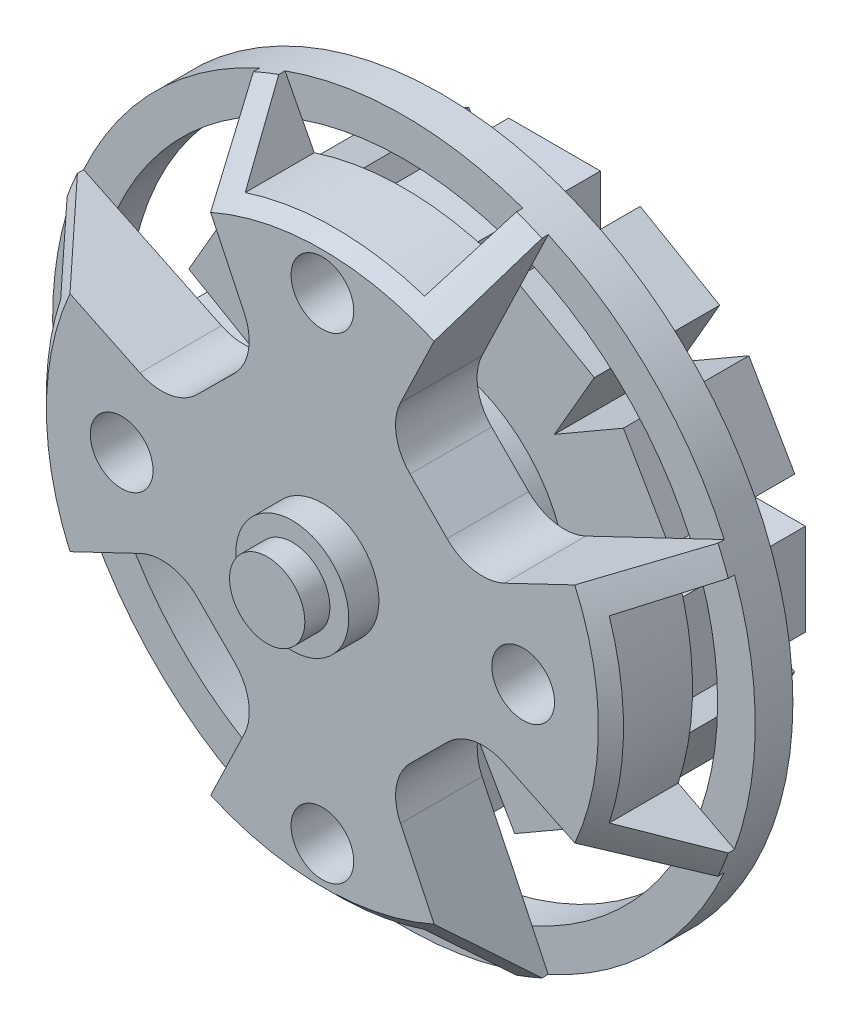
from build123d import *
from build123d.topology import SkipClean

# Parameters (mm, degrees)
EXTRUDE_1_DEPTH     = 3.25
EXTRUDE_START       = 1.5
SKETCH_2_R          = 14.000000000000027
SKETCH_2_R_2        = 12.499999999999906
EXTRUDE_2_DEPTH     = 1.5
CHAMFER_1_SIZE      = 3
CUT_EXTRUDE_2_REACH = 22.361
SKETCH_3_R          = 1.2500000000000002
SKETCH_3_R_2        = 1.2499999999999991
SKETCH_3_R_3        = 1.2499999999999998
SKETCH_3_R_4        = 1.250000000000001
SKETCH_4_R          = 2.25
EXTRUDE_3_DEPTH     = 1.2
SKETCH_6_R          = 1.5
EXTRUDE_4_DEPTH     = 1
SKETCH_7_R          = 5.5
EXTRUDE_5_DEPTH     = 1
EXTRUDE_6_DEPTH     = 5


with BuildPart() as part:
    # Эскиз1 → Бобышка-Вытянуть1 (new body)
    with BuildSketch(Plane.XY):
        with BuildLine():
            Line((-7.272076584167655, 3.111154183095137), (-12.764697411219743, 5.749999999999998))
            ThreePointArc((-12.764697411219743, 5.749999999999998), (-13.687690889209106, 2.9405982591067765), (-13.999999999999988, 0))
            ThreePointArc((-13.999999999999988, 0), (-13.68769088920912, -2.9405982591067032), (-12.764697411219801, -5.749999999999867))
            Line((-12.764697411219801, -5.749999999999867), (-7.25261222668815, -3.113400385794882))
            ThreePointArc((-7.25261222668815, -3.113400385794882), (-6.047780294633424, -2.947046212491201), (-4.969360809785696, -3.5094563032390873))
            Line((-4.969360809785696, -3.5094563032390873), (-3.493656572586229, -4.997814070292929))
            ThreePointArc((-3.493656572586229, -4.997814070292929), (-2.9415951503787445, -6.074261578843696), (-3.111154183095193, -7.272076584167621))
            Line((-3.111154183095193, -7.272076584167621), (-5.75000000000013, -12.764697411219682))
            ThreePointArc((-5.75000000000013, -12.764697411219682), (-2.940598259106871, -13.687690889209117), (-4.974e-14, -14.00000000000005))
            ThreePointArc((-4.974e-14, -14.00000000000005), (2.940598259106699, -13.687690889209104), (5.74999999999991, -12.764697411219782))
            Line((5.74999999999991, -12.764697411219782), (3.113400385794907, -7.252612226688141))
            ThreePointArc((3.113400385794907, -7.252612226688141), (2.9470462124912205, -6.047780294633415), (3.509456303239104, -4.969360809785686))
            Line((3.509456303239104, -4.969360809785686), (4.99781407029294, -3.493656572586213))
            ThreePointArc((4.99781407029294, -3.493656572586213), (6.074261578843707, -2.941595150378726), (7.272076584167633, -3.1111541830951692))
            Line((7.272076584167633, -3.1111541830951692), (12.764697411219702, -5.750000000000088))
            ThreePointArc((12.764697411219702, -5.750000000000088), (13.687690889209112, -2.9405982591068236), (14.00000000000005, 8.8e-16))
            ThreePointArc((14.00000000000005, 8.8e-16), (13.687690889209128, 2.9405982591067543), (12.764697411219764, 5.749999999999957))
            Line((12.764697411219764, 5.749999999999957), (7.2526122266881305, 3.113400385794934))
            ThreePointArc((7.2526122266881305, 3.113400385794934), (6.047780294633405, 2.9470462124912435), (4.969360809785673, 3.5094563032391233))
            Line((4.969360809785673, 3.5094563032391233), (3.493656572586196, 4.9978140702929545))
            ThreePointArc((3.493656572586196, 4.9978140702929545), (2.9415951503787046, 6.074261578843718), (3.111154183095144, 7.272076584167644))
            Line((3.111154183095144, 7.272076584167644), (5.750000000000043, 12.764697411219723))
            ThreePointArc((5.750000000000043, 12.764697411219723), (2.940598259106772, 13.68769088920909), (-4.802e-14, 14.00000000000005))
            ThreePointArc((-4.802e-14, 14.00000000000005), (-2.940598259106804, 13.687690889209133), (-5.75, 12.764697411219743))
            Line((-5.75, 12.764697411219743), (-3.113400385794959, 7.252612226688119))
            ThreePointArc((-3.113400385794959, 7.252612226688119), (-2.947046212491262, 6.047780294633395), (-3.5094563032391375, 4.969360809785661))
            Line((-3.5094563032391375, 4.969360809785661), (-4.997814070292954, 3.4936565725861874))
            ThreePointArc((-4.997814070292954, 3.4936565725861874), (-6.074261578843724, 2.941595150378682), (-7.272076584167655, 3.111154183095137))
        make_face()
    extrude(amount=EXTRUDE_1_DEPTH)

    # Эскиз2 → Бобышка-Вытянуть2 (add)
    with SkipClean():  # the faces are left unmerged after this step: merging them gives an invalid solid
        with BuildSketch(Plane(origin=(0, 0, 0), x_dir=(-1, 0, 0), z_dir=(0, 0, -1)).offset(EXTRUDE_START)):
            Circle(SKETCH_2_R)
            with Locations(Location((0, 0, 0), (0, 0, 204.080288301))):
                Circle(SKETCH_2_R_2, mode=Mode.SUBTRACT)
        extrude(amount=-EXTRUDE_2_DEPTH)

    # Фаска1
    chamfer_1_edges = [part.edges().sort_by_distance(p)[0] for p in [
        (-1.7286e-13, -14.000000000000046, 3.25),
        (-13.999999999999986, 7.35e-14, 3.25),
        (14.00000000000005, -9.981e-14, 3.25),
        (3.486e-14, 14.00000000000005, 3.25),
    ]]
    chamfer(chamfer_1_edges, length=CHAMFER_1_SIZE)

    # Вырез-Вытянуть2: up to this face of the body (flat: up to its plane)
    cut_extrude_2_end = Plane(part.part.faces().sort_by_distance((0, 0, 0))[0])
    # Эскиз3 → Вырез-Вытянуть2 (cut, up to the picked face)
    with BuildSketch(Plane.XY.offset(3.25), mode=Mode.PRIVATE) as cut_extrude_2_sk1:
        with Locations((-8, 0)):
            Circle(SKETCH_3_R)
    cut_extrude_2_tool1 = split(extrude(cut_extrude_2_sk1.sketch, amount=-CUT_EXTRUDE_2_REACH, mode=Mode.PRIVATE), bisect_by=cut_extrude_2_end, keep=Keep.BOTH, mode=Mode.PRIVATE)
    # Эскиз3 → Вырез-Вытянуть2 (cut, up to the picked face)
    with BuildSketch(Plane.XY.offset(3.25), mode=Mode.PRIVATE) as cut_extrude_2_sk2:
        with Locations((8, 0)):
            Circle(SKETCH_3_R_2)
    cut_extrude_2_tool2 = split(extrude(cut_extrude_2_sk2.sketch, amount=-CUT_EXTRUDE_2_REACH, mode=Mode.PRIVATE), bisect_by=cut_extrude_2_end, keep=Keep.BOTH, mode=Mode.PRIVATE)
    # Эскиз3 → Вырез-Вытянуть2 (cut, up to the picked face)
    with BuildSketch(Plane.XY.offset(3.25), mode=Mode.PRIVATE) as cut_extrude_2_sk3:
        with Locations((0, 9.5)):
            Circle(SKETCH_3_R_3)
    cut_extrude_2_tool3 = split(extrude(cut_extrude_2_sk3.sketch, amount=-CUT_EXTRUDE_2_REACH, mode=Mode.PRIVATE), bisect_by=cut_extrude_2_end, keep=Keep.BOTH, mode=Mode.PRIVATE)
    # Эскиз3 → Вырез-Вытянуть2 (cut, up to the picked face)
    with BuildSketch(Plane.XY.offset(3.25), mode=Mode.PRIVATE) as cut_extrude_2_sk4:
        with Locations((0, -9.5)):
            Circle(SKETCH_3_R_4)
    cut_extrude_2_tool4 = split(extrude(cut_extrude_2_sk4.sketch, amount=-CUT_EXTRUDE_2_REACH, mode=Mode.PRIVATE), bisect_by=cut_extrude_2_end, keep=Keep.BOTH, mode=Mode.PRIVATE)
    # Эскиз3 → Вырез-Вытянуть2 (cut, up to the picked face)
    with BuildSketch(Plane.XY.offset(3.25), mode=Mode.PRIVATE) as cut_extrude_2_sk5:
        with BuildLine():
            Line((-4.738786646254797, 13.173606230690137), (-3.574525297896844, 10.930359961808032))
            ThreePointArc((-3.574525297896844, 10.930359961808032), (7e-16, 11.500000000000027), (3.574525297896844, 10.930359961808032))
            Line((3.574525297896844, 10.930359961808032), (4.738786646254797, 13.173606230690137))
            ThreePointArc((4.738786646254797, 13.173606230690137), (8.6e-16, 14.000000000000028), (-4.738786646254797, 13.173606230690137))
        make_face()
    cut_extrude_2_tool5 = split(extrude(cut_extrude_2_sk5.sketch, amount=-CUT_EXTRUDE_2_REACH, mode=Mode.PRIVATE), bisect_by=cut_extrude_2_end, keep=Keep.BOTH, mode=Mode.PRIVATE)
    # Эскиз3 → Вырез-Вытянуть2 (cut, up to the picked face)
    with BuildSketch(Plane.XY.offset(3.25), mode=Mode.PRIVATE) as cut_extrude_2_sk6:
        with BuildLine():
            Line((13.173606230690154, 4.738786646254751), (10.930359961808044, 3.574525297896806))
            ThreePointArc((10.930359961808044, 3.574525297896806), (11.500000000000027, -4.022e-14), (10.93035996180802, -3.5745252978968822))
            Line((10.93035996180802, -3.5745252978968822), (13.173606230690119, -4.738786646254843))
            ThreePointArc((13.173606230690119, -4.738786646254843), (14.000000000000027, -4.896e-14), (13.173606230690154, 4.738786646254751))
        make_face()
    cut_extrude_2_tool6 = split(extrude(cut_extrude_2_sk6.sketch, amount=-CUT_EXTRUDE_2_REACH, mode=Mode.PRIVATE), bisect_by=cut_extrude_2_end, keep=Keep.BOTH, mode=Mode.PRIVATE)
    # Эскиз3 → Вырез-Вытянуть2 (cut, up to the picked face)
    with BuildSketch(Plane.XY.offset(3.25), mode=Mode.PRIVATE) as cut_extrude_2_sk7:
        with BuildLine():
            Line((4.738786646254705, -13.173606230690169), (3.5745252978967677, -10.930359961808056))
            ThreePointArc((3.5745252978967677, -10.930359961808056), (-8.101e-14, -11.500000000000027), (-3.5745252978969204, -10.930359961808007))
            Line((-3.5745252978969204, -10.930359961808007), (-4.738786646254889, -13.173606230690103))
            ThreePointArc((-4.738786646254889, -13.173606230690103), (-9.862e-14, -14.000000000000027), (4.738786646254705, -13.173606230690169))
        make_face()
    cut_extrude_2_tool7 = split(extrude(cut_extrude_2_sk7.sketch, amount=-CUT_EXTRUDE_2_REACH, mode=Mode.PRIVATE), bisect_by=cut_extrude_2_end, keep=Keep.BOTH, mode=Mode.PRIVATE)
    # Эскиз3 → Вырез-Вытянуть2 (cut, up to the picked face)
    with BuildSketch(Plane.XY.offset(3.25), mode=Mode.PRIVATE) as cut_extrude_2_sk8:
        with BuildLine():
            Line((-13.173606230690186, -4.738786646254658), (-10.930359961808069, -3.574525297896729))
            ThreePointArc((-10.930359961808069, -3.574525297896729), (-11.500000000000025, 1.2116e-13), (-10.930359961807993, 3.5745252978969595))
            Line((-10.930359961807993, 3.5745252978969595), (-13.173606230690085, 4.738786646254936))
            ThreePointArc((-13.173606230690085, 4.738786646254936), (-14.000000000000027, 1.5093e-13), (-13.173606230690186, -4.738786646254658))
        make_face()
    cut_extrude_2_tool8 = split(extrude(cut_extrude_2_sk8.sketch, amount=-CUT_EXTRUDE_2_REACH, mode=Mode.PRIVATE), bisect_by=cut_extrude_2_end, keep=Keep.BOTH, mode=Mode.PRIVATE)
    add(cut_extrude_2_tool1.solids().sort_by(Axis((-8, 0, 3.25), (0, 0, -1)))[0], mode=Mode.SUBTRACT)
    add(cut_extrude_2_tool2.solids().sort_by(Axis((8, 0, 3.25), (0, 0, -1)))[0], mode=Mode.SUBTRACT)
    add(cut_extrude_2_tool3.solids().sort_by(Axis((0, 9.5, 3.25), (0, 0, -1)))[0], mode=Mode.SUBTRACT)
    add(cut_extrude_2_tool4.solids().sort_by(Axis((0, -9.5, 3.25), (0, 0, -1)))[0], mode=Mode.SUBTRACT)
    add(cut_extrude_2_tool5.solids().sort_by(Axis((0, 12.573718, 3.25), (0, 0, -1)))[0], mode=Mode.SUBTRACT)
    add(cut_extrude_2_tool6.solids().sort_by(Axis((12.573718, 0, 3.25), (0, 0, -1)))[0], mode=Mode.SUBTRACT)
    add(cut_extrude_2_tool7.solids().sort_by(Axis((0, -12.573718, 3.25), (0, 0, -1)))[0], mode=Mode.SUBTRACT)
    add(cut_extrude_2_tool8.solids().sort_by(Axis((-12.573718, 0, 3.25), (0, 0, -1)))[0], mode=Mode.SUBTRACT)

    # Эскиз4 → Бобышка-Вытянуть3 (add)
    with SkipClean():  # the faces are left unmerged after this step: merging them gives an invalid solid
        with BuildSketch(Plane.XY.offset(3.25)):
            with Locations(Location((0, 0, 0), (0, 0, 180))):
                Circle(SKETCH_4_R)
        extrude(amount=EXTRUDE_3_DEPTH)

    # Эскиз6 → Бобышка-Вытянуть4 (add)
    with SkipClean():  # the faces are left unmerged after this step: merging them gives an invalid solid
        with BuildSketch(Plane.XY.offset(4.45)):
            Circle(SKETCH_6_R)
        extrude(amount=EXTRUDE_4_DEPTH)

    # Эскиз7 → Бобышка-Вытянуть5 (add)
    with SkipClean():  # the faces are left unmerged after this step: merging them gives an invalid solid
        with BuildSketch(Plane(origin=(0, 0, 0), x_dir=(-1, 0, 0), z_dir=(0, 0, -1))):
            Circle(SKETCH_7_R)
        extrude(amount=EXTRUDE_5_DEPTH)

    # Эскиз8 → Бобышка-Вытянуть6 (add)
    with SkipClean():  # the faces are left unmerged after this step: merging them gives an invalid solid
        with BuildSketch(Plane(origin=(0, 0, -1), x_dir=(-1, 0, 0), z_dir=(0, 0, -1))):
            Polygon((-1.8286367370263235, 9.999999999999904), (1.8286367370263235, 9.999999999999904), (1.8286367370263241, 6.824565211169193), (3.4163541314416523, 9.57457240635755), (6.5836458685582135, 7.745935669331226), (4.995928474142883, 4.995928474142866), (7.745935669331147, 6.583645868558398), (9.57457240635747, 3.4163541314418384), (6.8245652111691975, 1.8286367370262993), (9.999999999999972, 1.8286367370265468), (9.999999999999972, -1.8286367370261), (6.824565211169186, -1.828636737026348), (9.574572406357618, -3.416354131441428), (7.745935669331295, -6.58364586855799), (4.995928474142845, -4.995928474142898), (6.5836458685584685, -7.745935669330923), (3.416354131441909, -9.574572406357246), (1.828636737026489, -6.824565211169578), (1.8286367370266157, -9.99999999999975), (-1.8286367370260312, -9.99999999999975), (-1.828636737026372, -6.824565211169182), (-3.416354131441359, -9.574572406357396), (-6.5836458685579204, -7.745935669331072), (-4.995928474142918, -4.995928474142831), (-7.745935669330854, -6.583645868558247), (-9.574572406357179, -3.416354131441687), (-6.824565211169213, -1.8286367370262528), (-9.999999999999682, -1.8286367370263936), (-9.999999999999682, 1.8286367370262533), (-6.824565211169262, 1.828636737026395), (-9.57457240635733, 3.4163541314415777), (-7.745935669331009, 6.583645868558139), (-4.995928474142862, 4.995928474142964), (-6.583645868558178, 7.745935669331077), (-3.4163541314416186, 9.574572406357401), (-1.828636737026324, 6.824565211169384), align=None)
            Polygon((-0.9110272542657695, 3.3999999999999058), (0.9110272542657935, 3.3999999999999058), (2.488972745734119, 2.48897274573411), (3.3999999999999093, 0.9110272542657816), (3.3999999999999027, -0.9110272542658054), (2.488972745734102, -2.4889727457341264), (0.9110272542657677, -3.3999999999999124), (-0.9110272542658163, -3.3999999999999004), (-2.4889727457341366, -2.4889727457340918), (-3.399999999999915, -0.9110272542657586), (-3.399999999999896, 0.9110272542658285), (-2.4889727457341553, 2.488972745734021), align=None, mode=Mode.SUBTRACT)
        extrude(amount=EXTRUDE_6_DEPTH)


solid = part.part
